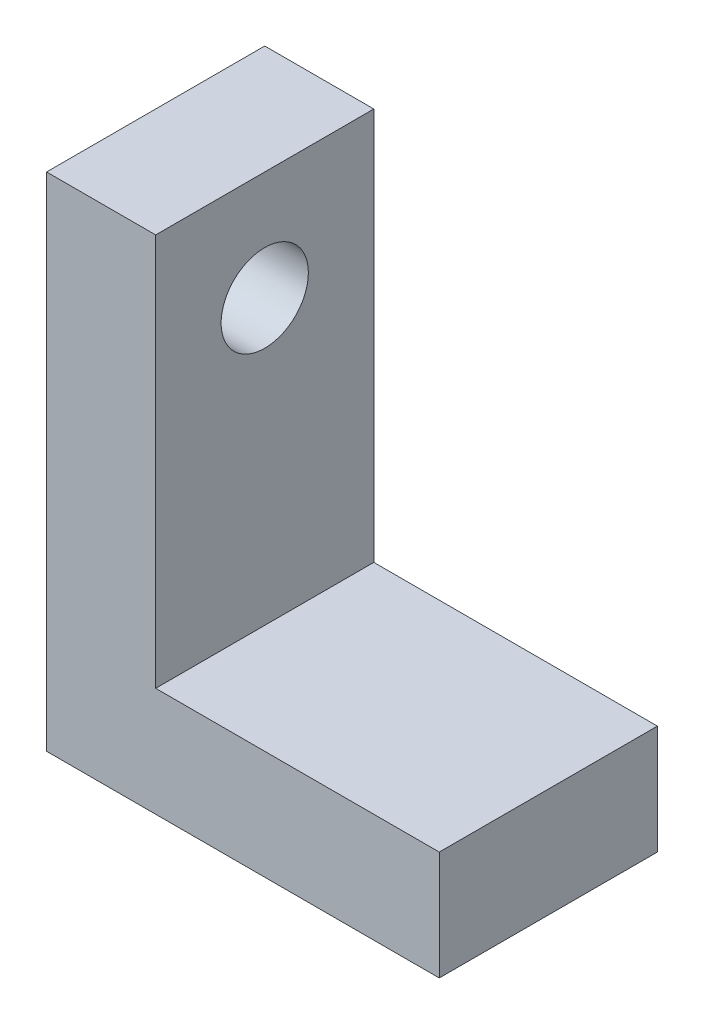
from build123d import *

# Parameters (mm, degrees)
SALIENTE_EXTRUIR1_DEPTH = 5
CROQUIS2_R              = 2
CORTAR_EXTRUIR1_DEPTH   = 27.888659319


with BuildPart() as part:
    # Croquis1 → Saliente-Extruir1 (new, symmetric)
    with BuildSketch(Plane.XY):
        Polygon((0, 0), (0, 23), (5, 23), (5, 5), (18, 5), (18, 0), align=None)
    extrude(amount=SALIENTE_EXTRUIR1_DEPTH, both=True)

    # Croquis2 → Cortar-Extruir1 (cut, through all)
    with BuildSketch(Plane(origin=(5, 0, 0), x_dir=(0, 0, -1), z_dir=(1, 0, 0))):
        with Locations((0, 18)):
            Circle(CROQUIS2_R)
    extrude(amount=-CORTAR_EXTRUIR1_DEPTH, mode=Mode.SUBTRACT)


solid = part.part
